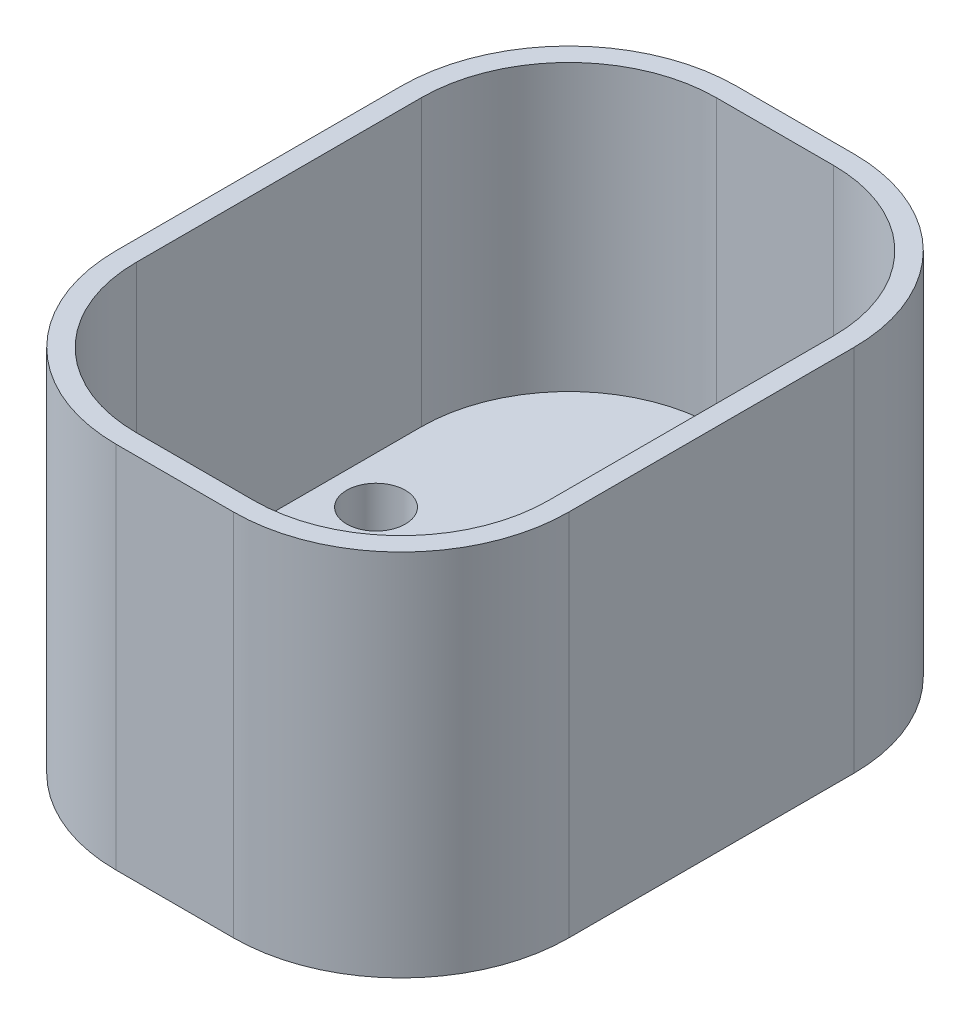
from build123d import *

# Parameters (mm, degrees)
SKETCH1_W           = 27
SKETCH1_H           = 37
SKETCH1_R           = 8.05
SKETCH1_R_2         = 1.5
SKETCH1_R_3         = 1.75
BOSS_EXTRUDE1_DEPTH = 5
SKETCH1_4_R         = 1.5
BOSS_EXTRUDE3_DEPTH = 4.95
SKETCH1_5_R         = 8.05
SKETCH1_5_R_2       = 2.8
BOSS_EXTRUDE4_DEPTH = 2
FILLET1_R           = 10
BOSS_EXTRUDE5_START = 17
BOSS_EXTRUDE5_DEPTH = 17


with BuildPart() as part:
    # Sketch1 → Boss-Extrude1 (new body)
    with BuildSketch(Plane(origin=(0, 0, 0), x_dir=(1, 0, 0), z_dir=(0, 1, 0))):
        with Locations((0, 5)):
            Rectangle(SKETCH1_W, SKETCH1_H)
        with Locations(Location((0, 0, 0), (0, 0, 270))):
            Circle(SKETCH1_R, mode=Mode.SUBTRACT)
        with Locations(Location((0, 13.337, 0), (0, 0, 270))):
            Circle(SKETCH1_R_2, mode=Mode.SUBTRACT)
        with Locations(Location((-9.5, 8, 0), (0, 0, 270))):
            Circle(SKETCH1_R_3, mode=Mode.SUBTRACT)
        with Locations(Location((9.5, 8, 0), (0, 0, 270))):
            Circle(SKETCH1_R_3, mode=Mode.SUBTRACT)
    extrude(amount=BOSS_EXTRUDE1_DEPTH)

    # Sketch1<4> → Boss-Extrude3 (add)
    with BuildSketch(Plane(origin=(0, 0, 0), x_dir=(1, 0, 0), z_dir=(0, 1, 0))):
        with Locations(Location((0, 13.337, 0), (0, 0, 270))):
            Circle(SKETCH1_4_R)
    extrude(amount=BOSS_EXTRUDE3_DEPTH)

    # Sketch1<5> → Boss-Extrude4 (add)
    # profile 1 of 3: a face of its own
    with BuildSketch(Plane(origin=(0, 0, 0), x_dir=(1, 0, 0), z_dir=(0, 1, 0))):
        with Locations(Location((0, 0, 0), (0, 0, 270))):
            Circle(SKETCH1_5_R)
        with Locations(Location((0, 0, 0), (0, 0, 270))):
            Circle(SKETCH1_5_R_2, mode=Mode.SUBTRACT)
    # profile 2 of 3: a face of its own
    with BuildSketch(Plane(origin=(0, 0, 0), x_dir=(1, 0, 0), z_dir=(0, 1, 0))):
        with BuildLine():
            ThreePointArc((-5.45, 5.924525297), (-5.753510872, 5.630240905), (-6.041153839, 5.320428582))
            Line((-6.041153839, 5.320428582), (-5.45, 5.66173141))
            Line((-5.45, 5.66173141), (-5.45, 5.924525297))
        make_face()
    # profile 3 of 3: a face of its own
    with BuildSketch(Plane(origin=(0, 0, 0), x_dir=(1, 0, 0), z_dir=(0, 1, 0))):
        with BuildLine():
            Line((5.45, 5.66173141), (6.041153839, 5.320428582))
            ThreePointArc((6.041153839, 5.320428582), (5.753510872, 5.630240905), (5.45, 5.924525297))
            Line((5.45, 5.924525297), (5.45, 5.66173141))
        make_face()
    extrude(amount=BOSS_EXTRUDE4_DEPTH)

    # Fillet1
    fillet1_edges = [part.edges().sort_by_distance(p)[0] for p in [
        (-13.5, 2.5, -23.5),
        (13.5, 2.5, -23.5),
        (13.5, 2.5, 13.5),
        (-13.5, 2.5, 13.5),
    ]]
    fillet(fillet1_edges, radius=FILLET1_R)

    # Sketch2 → Boss-Extrude5 (add)
    with BuildSketch(Plane(origin=(0, 5, 0), x_dir=(1, 0, 0), z_dir=(0, 1, 0)).offset(BOSS_EXTRUDE5_START)):
        with BuildLine():
            Line((13.5, -3.5), (13.5, 13.5))
            ThreePointArc((13.5, 13.5), (10.571067812, 20.571067812), (3.5, 23.5))
            Line((3.5, 23.5), (-3.5, 23.5))
            ThreePointArc((-3.5, 23.5), (-10.571067812, 20.571067812), (-13.5, 13.5))
            Line((-13.5, 13.5), (-13.5, -3.5))
            ThreePointArc((-13.5, -3.5), (-10.571067812, -10.571067812), (-3.5, -13.5))
            Line((-3.5, -13.5), (3.5, -13.5))
            ThreePointArc((3.5, -13.5), (10.571067812, -10.571067812), (13.5, -3.5))
        make_face()
        with BuildLine():
            Line((-12.3, 13.5), (-12.3, -3.5))
            ThreePointArc((-12.3, -3.5), (-9.722539674, -9.722539674), (-3.5, -12.3))
            Line((-3.5, -12.3), (3.5, -12.3))
            ThreePointArc((3.5, -12.3), (9.722539674, -9.722539674), (12.3, -3.5))
            Line((12.3, -3.5), (12.3, 13.5))
            ThreePointArc((12.3, 13.5), (9.722539674, 19.722539674), (3.5, 22.3))
            Line((3.5, 22.3), (-3.5, 22.3))
            ThreePointArc((-3.5, 22.3), (-9.722539674, 19.722539674), (-12.3, 13.5))
        make_face(mode=Mode.SUBTRACT)
    extrude(amount=-BOSS_EXTRUDE5_DEPTH)


solid = part.part
